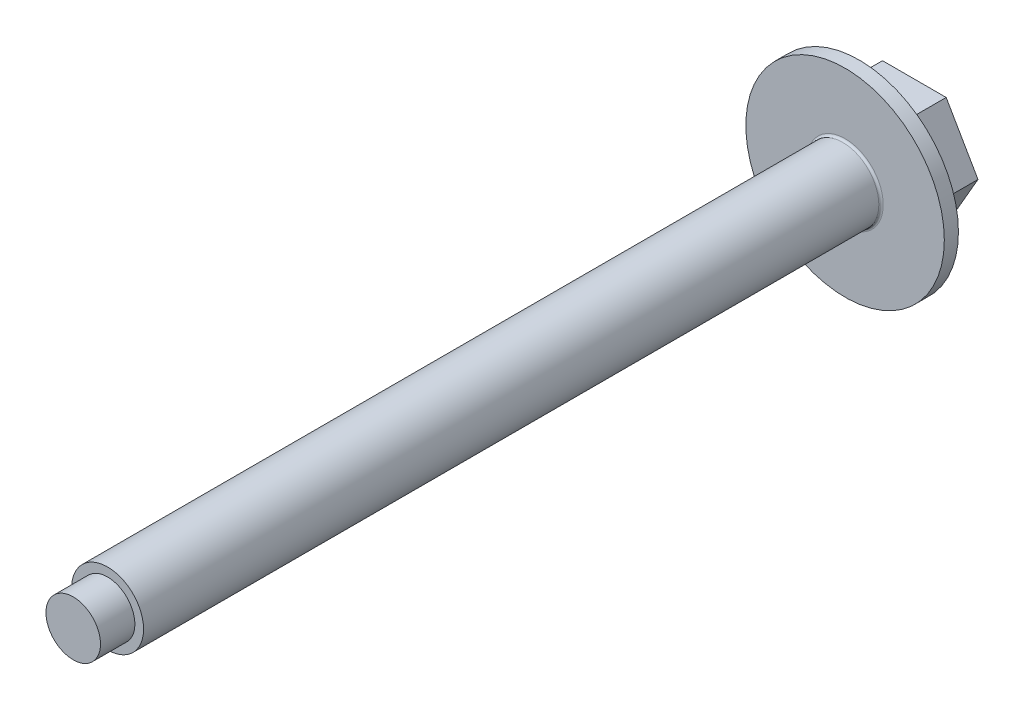
from build123d import *

# Parameters (mm, degrees)
BOSS_EXTRUDE1_DEPTH = 3.175
SKETCH2_R           = 5.715
BOSS_EXTRUDE2_DEPTH = 0.8128
SKETCH3_R           = 2.0701
BOSS_EXTRUDE3_DEPTH = 44.45
FILLET1_R           = 0.127
SKETCH4_OUTSIDE_W   = 23.642
SKETCH4_OUTSIDE_H   = 23.642
SKETCH4_OUTSIDE_R   = 1.5701
CUT_EXTRUDE1_DEPTH  = 1.9812


with BuildPart() as part:
    # Sketch1 → Boss-Extrude1 (new body)
    with BuildSketch(Plane.XY):
        Polygon((3.666174209, 0), (1.833087105, 3.175), (-1.833087105, 3.175), (-3.666174209, 0), (-1.833087105, -3.175), (1.833087105, -3.175), align=None)
    extrude(amount=BOSS_EXTRUDE1_DEPTH)

    # Sketch2 → Boss-Extrude2 (add)
    with BuildSketch(Plane.XY.offset(3.175)):
        Circle(SKETCH2_R)
    extrude(amount=BOSS_EXTRUDE2_DEPTH)

    # Sketch3 → Boss-Extrude3 (add)
    with BuildSketch(Plane.XY.offset(3.9878)):
        Circle(SKETCH3_R)
    extrude(amount=BOSS_EXTRUDE3_DEPTH)

    # Fillet1
    fillet1_edges = [part.edges().sort_by_distance(p)[0] for p in [
        (-2.0701, 0, 3.9878),
    ]]
    fillet(fillet1_edges, radius=FILLET1_R)

    # Sketch4 outside → Cut-Extrude1 (cut)
    with BuildSketch(Plane.XY.offset(48.4378)):
        Rectangle(SKETCH4_OUTSIDE_W, SKETCH4_OUTSIDE_H)
        Circle(SKETCH4_OUTSIDE_R, mode=Mode.SUBTRACT)
    extrude(amount=-CUT_EXTRUDE1_DEPTH, mode=Mode.SUBTRACT)


solid = part.part
